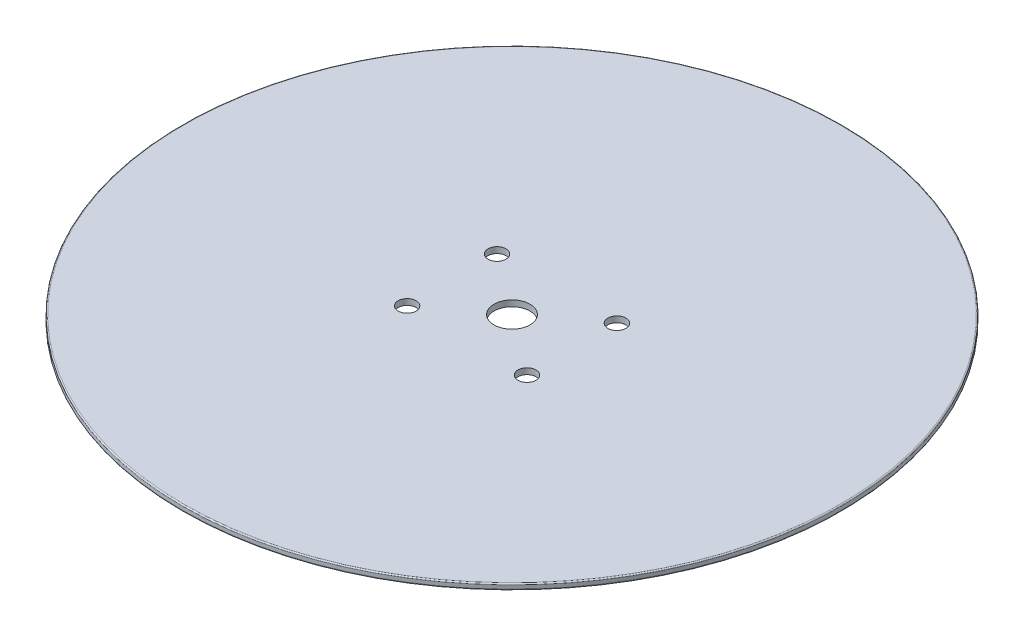
from build123d import *

# Parameters (mm, degrees)
SKETCH1_R           = 55
BOSS_EXTRUDE1_DEPTH = 1
FILLET2_R           = 0.2
SKETCH4_R           = 3
CUT_EXTRUDE2_DEPTH  = 78.78817405
SKETCH3_R           = 1.5
CUT_EXTRUDE3_DEPTH  = 78.78817405


with BuildPart() as part:
    # Sketch1 → Boss-Extrude1 (new body)
    with BuildSketch(Plane(origin=(0, 0, 0), x_dir=(1, 0, 0), z_dir=(0, 1, 0))):
        with Locations(Location((0, 0, 0), (0, 0, 270))):
            Circle(SKETCH1_R)
    extrude(amount=BOSS_EXTRUDE1_DEPTH)

    # Fillet2
    fillet2_edges = [part.edges().sort_by_distance(p)[0] for p in [
        (0, 0, -55),
        (0, 1, -55),
    ]]
    fillet(fillet2_edges, radius=FILLET2_R)

    # Sketch4 → Cut-Extrude2 (cut, through all)
    with BuildSketch(Plane(origin=(0, 1, 0), x_dir=(1, 0, 0), z_dir=(0, 1, 0))):
        with Locations(Location((0, 0, 0), (0, 0, 270))):
            Circle(SKETCH4_R)
    extrude(amount=-CUT_EXTRUDE2_DEPTH, mode=Mode.SUBTRACT)

    # Sketch3 → Cut-Extrude3 (cut, through all)
    with BuildSketch(Plane(origin=(0, 1, 0), x_dir=(1, 0, 0), z_dir=(0, 1, 0))):
        with Locations(Location((-10, 7.5, 0), (0, 0, 270))):
            Circle(SKETCH3_R)
        with Locations(Location((10, 7.5, 0), (0, 0, 270))):
            Circle(SKETCH3_R)
        with Locations(Location((10, -7.5, 0), (0, 0, 270))):
            Circle(SKETCH3_R)
        with Locations(Location((-10, -7.5, 0), (0, 0, 270))):
            Circle(SKETCH3_R)
    extrude(amount=-CUT_EXTRUDE3_DEPTH, mode=Mode.SUBTRACT)


solid = part.part
